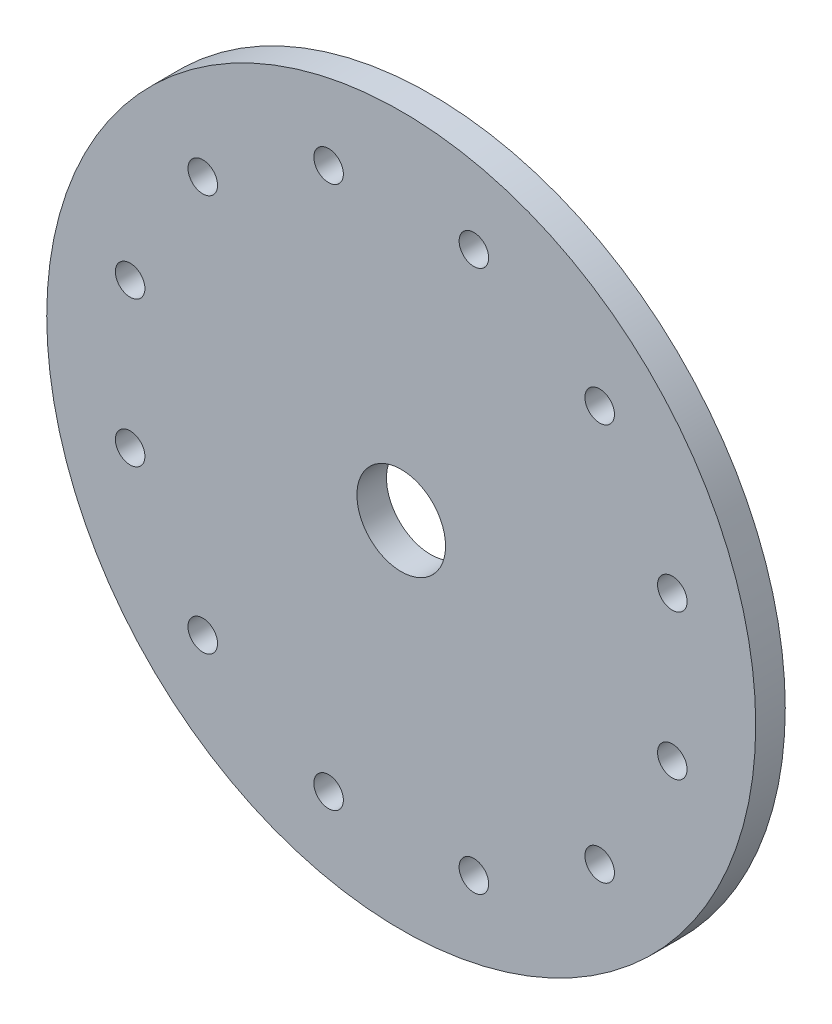
from build123d import *

# Parameters (mm, degrees)
SKETCH1_R           = 152.4
SKETCH1_R_2         = 19.05
BOSS_EXTRUDE1_DEPTH = 12.7
SKETCH2_R           = 6.35
CUT_EXTRUDE2_DEPTH  = 216.9
CRVPATTERN1_COUNT   = 12


with BuildPart() as part:
    # Sketch1 → Boss-Extrude1 (new body)
    with BuildSketch(Plane.XY):
        Circle(SKETCH1_R)
        Circle(SKETCH1_R_2, mode=Mode.SUBTRACT)
    extrude(amount=BOSS_EXTRUDE1_DEPTH)

    # Sketch2 → Cut-Extrude2 (cut, symmetric)
    with BuildSketch(Plane.XY):
        with Locations((85.31243315, 85.31243315)):
            Circle(SKETCH2_R)
    cut_extrude2 = extrude(amount=CUT_EXTRUDE2_DEPTH, both=True, mode=Mode.SUBTRACT)

    # CrvPattern1: Cut-Extrude2 ×12 about axis
    crvpattern1_axis = Axis((0, 0, 0), (0, 0, 1))
    for i in range(1, CRVPATTERN1_COUNT):
        add(cut_extrude2.rotate(crvpattern1_axis, i * 360 / CRVPATTERN1_COUNT), mode=Mode.SUBTRACT)


solid = part.part
